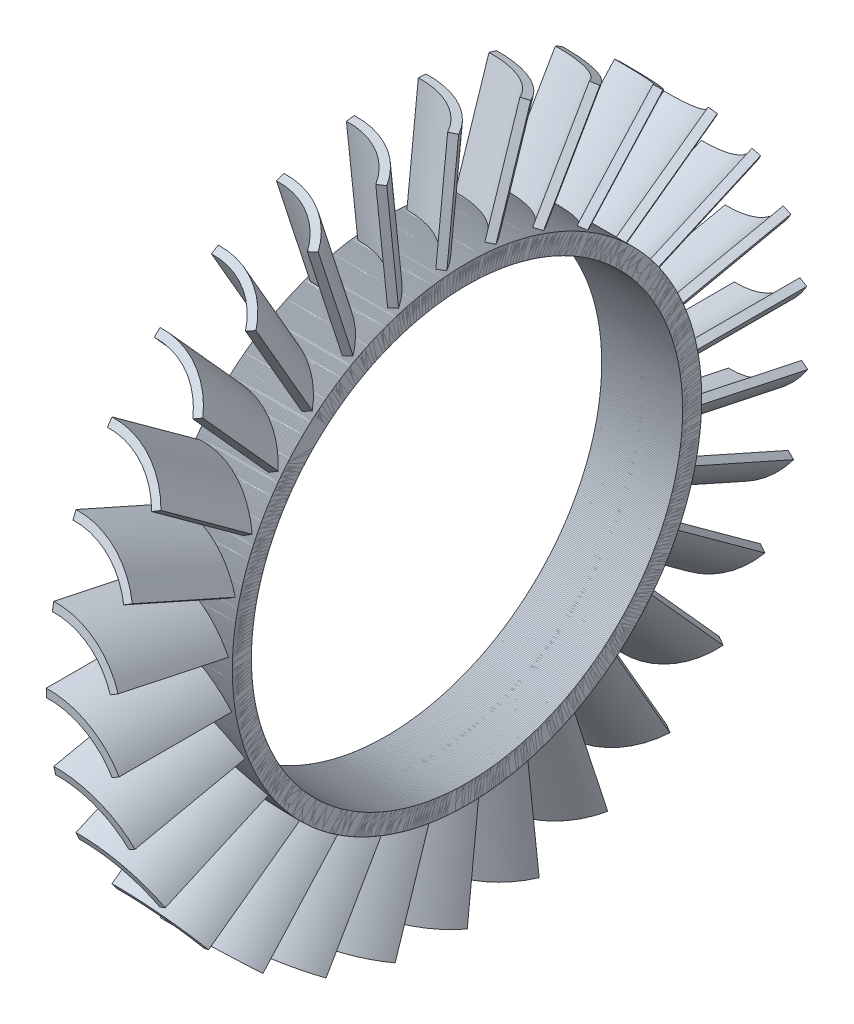
from build123d import *

# Parameters (mm, degrees)
SKETCH1_R           = 58
SKETCH1_R_2         = 53
BOSS_EXTRUDE1_DEPTH = 10
EXTRUDE_THIN1_DEPTH = 85
SKETCH5_R           = 53.32610028
CUT_EXTRUDE2_DEPTH  = 42.5
CIRPATTERN2_COUNT   = 30


with BuildPart() as part:
    # Sketch1 → Boss-Extrude1 (new, symmetric)
    with BuildSketch(Plane(origin=(0, 0, 0), x_dir=(0, 0, -1), z_dir=(1, 0, 0))):
        Circle(SKETCH1_R)
        Circle(SKETCH1_R_2, mode=Mode.SUBTRACT)
    extrude(amount=BOSS_EXTRUDE1_DEPTH, both=True)

    # Sketch2 → Extrude-Thin1 (add)
    with BuildSketch(Plane.XY):
        with BuildLine():
            ThreePointArc((-9, 0), (1.384187406, -2.50846267), (9, -10))
            Line((9, -10), (7.267900844, -10.999916253))
            ThreePointArc((7.267900844, -10.999916253), (0.412901543, -4.256777222), (-8.933914246, -1.99890787))
            Line((-8.933914246, -1.99890787), (-9, 0))
        make_face()
    extrude(amount=EXTRUDE_THIN1_DEPTH)

    # Sketch5 → Cut-Extrude2 (cut, symmetric)
    with BuildSketch(Plane(origin=(0, 0, 0), x_dir=(0, 0, -1), z_dir=(1, 0, 0))):
        Circle(SKETCH5_R)
    extrude(amount=CUT_EXTRUDE2_DEPTH, both=True, mode=Mode.SUBTRACT)


with BuildPart() as cirpattern2_1:
    # CirPattern2: pattern copy
    add(part.part.rotate(Axis((0, 0, 0), (1, 0, 0)), 1 * 360 / CIRPATTERN2_COUNT))


with BuildPart() as cirpattern2_2:
    # CirPattern2: pattern copy
    add(part.part.rotate(Axis((0, 0, 0), (1, 0, 0)), 2 * 360 / CIRPATTERN2_COUNT))


with BuildPart() as cirpattern2_3:
    # CirPattern2: pattern copy
    add(part.part.rotate(Axis((0, 0, 0), (1, 0, 0)), 3 * 360 / CIRPATTERN2_COUNT))


with BuildPart() as cirpattern2_4:
    # CirPattern2: pattern copy
    add(part.part.rotate(Axis((0, 0, 0), (1, 0, 0)), 4 * 360 / CIRPATTERN2_COUNT))


with BuildPart() as cirpattern2_5:
    # CirPattern2: pattern copy
    add(part.part.rotate(Axis((0, 0, 0), (1, 0, 0)), 5 * 360 / CIRPATTERN2_COUNT))


with BuildPart() as cirpattern2_6:
    # CirPattern2: pattern copy
    add(part.part.rotate(Axis((0, 0, 0), (1, 0, 0)), 6 * 360 / CIRPATTERN2_COUNT))


with BuildPart() as cirpattern2_7:
    # CirPattern2: pattern copy
    add(part.part.rotate(Axis((0, 0, 0), (1, 0, 0)), 7 * 360 / CIRPATTERN2_COUNT))


with BuildPart() as cirpattern2_8:
    # CirPattern2: pattern copy
    add(part.part.rotate(Axis((0, 0, 0), (1, 0, 0)), 8 * 360 / CIRPATTERN2_COUNT))


with BuildPart() as cirpattern2_9:
    # CirPattern2: pattern copy
    add(part.part.rotate(Axis((0, 0, 0), (1, 0, 0)), 9 * 360 / CIRPATTERN2_COUNT))


with BuildPart() as cirpattern2_10:
    # CirPattern2: pattern copy
    add(part.part.rotate(Axis((0, 0, 0), (1, 0, 0)), 10 * 360 / CIRPATTERN2_COUNT))


with BuildPart() as cirpattern2_11:
    # CirPattern2: pattern copy
    add(part.part.rotate(Axis((0, 0, 0), (1, 0, 0)), 11 * 360 / CIRPATTERN2_COUNT))


with BuildPart() as cirpattern2_12:
    # CirPattern2: pattern copy
    add(part.part.rotate(Axis((0, 0, 0), (1, 0, 0)), 12 * 360 / CIRPATTERN2_COUNT))


with BuildPart() as cirpattern2_13:
    # CirPattern2: pattern copy
    add(part.part.rotate(Axis((0, 0, 0), (1, 0, 0)), 13 * 360 / CIRPATTERN2_COUNT))


with BuildPart() as cirpattern2_14:
    # CirPattern2: pattern copy
    add(part.part.rotate(Axis((0, 0, 0), (1, 0, 0)), 14 * 360 / CIRPATTERN2_COUNT))


with BuildPart() as cirpattern2_15:
    # CirPattern2: pattern copy
    add(part.part.rotate(Axis((0, 0, 0), (1, 0, 0)), 15 * 360 / CIRPATTERN2_COUNT))


with BuildPart() as cirpattern2_16:
    # CirPattern2: pattern copy
    add(part.part.rotate(Axis((0, 0, 0), (1, 0, 0)), 16 * 360 / CIRPATTERN2_COUNT))


with BuildPart() as cirpattern2_17:
    # CirPattern2: pattern copy
    add(part.part.rotate(Axis((0, 0, 0), (1, 0, 0)), 17 * 360 / CIRPATTERN2_COUNT))


with BuildPart() as cirpattern2_18:
    # CirPattern2: pattern copy
    add(part.part.rotate(Axis((0, 0, 0), (1, 0, 0)), 18 * 360 / CIRPATTERN2_COUNT))


with BuildPart() as cirpattern2_19:
    # CirPattern2: pattern copy
    add(part.part.rotate(Axis((0, 0, 0), (1, 0, 0)), 19 * 360 / CIRPATTERN2_COUNT))


with BuildPart() as cirpattern2_20:
    # CirPattern2: pattern copy
    add(part.part.rotate(Axis((0, 0, 0), (1, 0, 0)), 20 * 360 / CIRPATTERN2_COUNT))


with BuildPart() as cirpattern2_21:
    # CirPattern2: pattern copy
    add(part.part.rotate(Axis((0, 0, 0), (1, 0, 0)), 21 * 360 / CIRPATTERN2_COUNT))


with BuildPart() as cirpattern2_22:
    # CirPattern2: pattern copy
    add(part.part.rotate(Axis((0, 0, 0), (1, 0, 0)), 22 * 360 / CIRPATTERN2_COUNT))


with BuildPart() as cirpattern2_23:
    # CirPattern2: pattern copy
    add(part.part.rotate(Axis((0, 0, 0), (1, 0, 0)), 23 * 360 / CIRPATTERN2_COUNT))


with BuildPart() as cirpattern2_24:
    # CirPattern2: pattern copy
    add(part.part.rotate(Axis((0, 0, 0), (1, 0, 0)), 24 * 360 / CIRPATTERN2_COUNT))


with BuildPart() as cirpattern2_25:
    # CirPattern2: pattern copy
    add(part.part.rotate(Axis((0, 0, 0), (1, 0, 0)), 25 * 360 / CIRPATTERN2_COUNT))


with BuildPart() as cirpattern2_26:
    # CirPattern2: pattern copy
    add(part.part.rotate(Axis((0, 0, 0), (1, 0, 0)), 26 * 360 / CIRPATTERN2_COUNT))


with BuildPart() as cirpattern2_27:
    # CirPattern2: pattern copy
    add(part.part.rotate(Axis((0, 0, 0), (1, 0, 0)), 27 * 360 / CIRPATTERN2_COUNT))


with BuildPart() as cirpattern2_28:
    # CirPattern2: pattern copy
    add(part.part.rotate(Axis((0, 0, 0), (1, 0, 0)), 28 * 360 / CIRPATTERN2_COUNT))


with BuildPart() as cirpattern2_29:
    # CirPattern2: pattern copy
    add(part.part.rotate(Axis((0, 0, 0), (1, 0, 0)), 29 * 360 / CIRPATTERN2_COUNT))


solid = Compound([part.part, cirpattern2_1.part, cirpattern2_2.part, cirpattern2_3.part, cirpattern2_4.part, cirpattern2_5.part, cirpattern2_6.part, cirpattern2_7.part, cirpattern2_8.part, cirpattern2_9.part, cirpattern2_10.part, cirpattern2_11.part, cirpattern2_12.part, cirpattern2_13.part, cirpattern2_14.part, cirpattern2_15.part, cirpattern2_16.part, cirpattern2_17.part, cirpattern2_18.part, cirpattern2_19.part, cirpattern2_20.part, cirpattern2_21.part, cirpattern2_22.part, cirpattern2_23.part, cirpattern2_24.part, cirpattern2_25.part, cirpattern2_26.part, cirpattern2_27.part, cirpattern2_28.part, cirpattern2_29.part])
